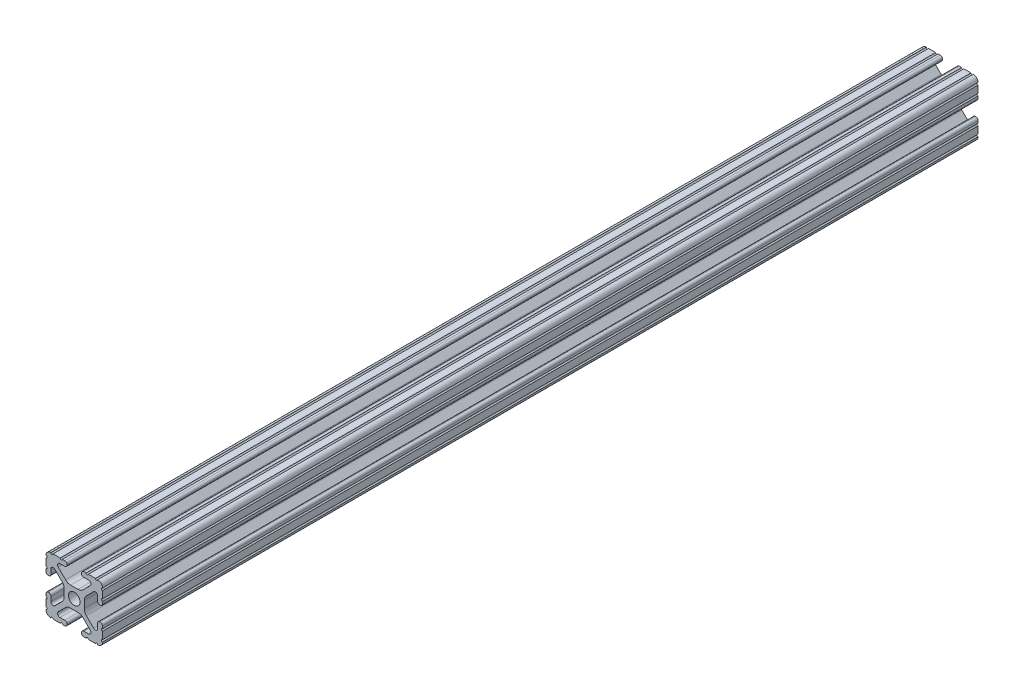
from build123d import *

# Parameters (mm, degrees)
SKETCH1_R           = 2.6035
BOSS_EXTRUDE1_DEPTH = 304.8
SKETCH4_W           = 111.881227381
SKETCH4_H           = 93.826727356
CUT_EXTRUDE3_DEPTH  = 215.9


with BuildPart() as part:
    # Sketch1 → Boss-Extrude1 (new, symmetric)
    with BuildSketch(Plane.XY):
        with BuildLine():
            Line((-7.179650497, -8.645192506), (-3.952270251, -5.423690499))
            ThreePointArc((-3.952270251, -5.423690499), (-2.922936451, -4.736929036), (-1.709253557, -4.4958))
            Line((-1.709253557, -4.4958), (1.709253557, -4.4958))
            ThreePointArc((1.709253557, -4.4958), (2.922936451, -4.736929036), (3.952270251, -5.423690499))
            Line((3.952270251, -5.423690499), (7.179650497, -8.645192506))
            ThreePointArc((7.179650497, -8.645192506), (7.41473083, -9.822813117), (6.416408329, -10.4902))
            Line((6.416408329, -10.4902), (4.287512407, -10.4902))
            ThreePointArc((4.287512407, -10.4902), (3.54574862, -10.79744862), (3.2385, -11.539212407))
            Line((3.2385, -11.539212407), (3.2385, -11.650987593))
            ThreePointArc((3.2385, -11.650987593), (3.54574862, -12.39275138), (4.287512407, -12.7))
            Line((4.287512407, -12.7), (5.317126718, -12.7))
            ThreePointArc((5.317126718, -12.7), (5.825126718, -12.192), (6.333126718, -12.7))
            Line((6.333126718, -12.7), (9.550443118, -12.7))
            ThreePointArc((9.550443118, -12.7), (10.058366869, -12.192000006), (10.566443095, -12.699847501))
            ThreePointArc((10.566443095, -12.699847501), (12.082537762, -12.08250727), (12.699846982, -10.566399977))
            ThreePointArc((12.699846982, -10.566399977), (12.192000006, -10.058323491), (12.7, -9.5504))
            Line((12.7, -9.5504), (12.7, -6.3330836))
            ThreePointArc((12.7, -6.3330836), (12.192, -5.8250836), (12.7, -5.3170836))
            Line((12.7, -5.3170836), (12.7, -4.287469289))
            ThreePointArc((12.7, -4.287469289), (12.39275138, -3.545705502), (11.650987593, -3.238456882))
            Line((11.650987593, -3.238456882), (11.539212407, -3.238456882))
            ThreePointArc((11.539212407, -3.238456882), (10.79744862, -3.545705502), (10.4902, -4.287469289))
            Line((10.4902, -4.287469289), (10.4902, -6.402089023))
            ThreePointArc((10.4902, -6.402089023), (9.856505071, -7.351067942), (8.737131347, -7.129408934))
            Line((8.737131347, -7.129408934), (5.441005833, -3.840816462))
            ThreePointArc((5.441005833, -3.840816462), (4.750877967, -2.809883091), (4.5085, -1.593185507))
            Line((4.5085, -1.593185507), (4.5085, 1.593185507))
            ThreePointArc((4.5085, 1.593185507), (4.750877967, 2.809883091), (5.441005833, 3.840816462))
            Line((5.441005833, 3.840816462), (8.737131347, 7.129408934))
            ThreePointArc((8.737131347, 7.129408934), (9.856505071, 7.351067942), (10.4902, 6.402089023))
            Line((10.4902, 6.402089023), (10.4902, 4.287469289))
            ThreePointArc((10.4902, 4.287469289), (10.79744862, 3.545705502), (11.539212407, 3.238456882))
            Line((11.539212407, 3.238456882), (11.650987593, 3.238456882))
            ThreePointArc((11.650987593, 3.238456882), (12.39275138, 3.545705502), (12.7, 4.287469289))
            Line((12.7, 4.287469289), (12.7, 5.3170836))
            ThreePointArc((12.7, 5.3170836), (12.192, 5.8250836), (12.7, 6.3330836))
            Line((12.7, 6.3330836), (12.7, 9.5504))
            ThreePointArc((12.7, 9.5504), (12.192000006, 10.058323491), (12.699846982, 10.566399977))
            ThreePointArc((12.699846982, 10.566399977), (12.082537762, 12.08250727), (10.566443095, 12.699847501))
            ThreePointArc((10.566443095, 12.699847501), (10.058366869, 12.192000006), (9.550443118, 12.7))
            Line((9.550443118, 12.7), (6.333126718, 12.7))
            ThreePointArc((6.333126718, 12.7), (5.825126718, 12.192), (5.317126718, 12.7))
            Line((5.317126718, 12.7), (4.287512407, 12.7))
            ThreePointArc((4.287512407, 12.7), (3.54574862, 12.39275138), (3.2385, 11.650987593))
            Line((3.2385, 11.650987593), (3.2385, 11.539212407))
            ThreePointArc((3.2385, 11.539212407), (3.54574862, 10.79744862), (4.287512407, 10.4902))
            Line((4.287512407, 10.4902), (6.476788598, 10.4902))
            ThreePointArc((6.476788598, 10.4902), (7.432222385, 9.85140422), (7.207036008, 8.724370562))
            Line((7.207036008, 8.724370562), (3.898272566, 5.423169045))
            ThreePointArc((3.898272566, 5.423169045), (2.869120213, 4.736787962), (1.655778399, 4.4958))
            Line((1.655778399, 4.4958), (-1.655778399, 4.4958))
            ThreePointArc((-1.655778399, 4.4958), (-2.869120213, 4.736787962), (-3.898272566, 5.423169045))
            Line((-3.898272566, 5.423169045), (-7.207036008, 8.724370562))
            ThreePointArc((-7.207036008, 8.724370562), (-7.432222385, 9.85140422), (-6.476788598, 10.4902))
            Line((-6.476788598, 10.4902), (-4.287512407, 10.4902))
            ThreePointArc((-4.287512407, 10.4902), (-3.54574862, 10.79744862), (-3.2385, 11.539212407))
            Line((-3.2385, 11.539212407), (-3.2385, 11.650987593))
            ThreePointArc((-3.2385, 11.650987593), (-3.54574862, 12.39275138), (-4.287512407, 12.7))
            Line((-4.287512407, 12.7), (-5.317126718, 12.7))
            ThreePointArc((-5.317126718, 12.7), (-5.825126718, 12.192), (-6.333126718, 12.7))
            Line((-6.333126718, 12.7), (-9.550443118, 12.7))
            ThreePointArc((-9.550443118, 12.7), (-10.058366869, 12.192000006), (-10.566443095, 12.699847501))
            ThreePointArc((-10.566443095, 12.699847501), (-12.082537762, 12.08250727), (-12.699846982, 10.566399977))
            ThreePointArc((-12.699846982, 10.566399977), (-12.192000006, 10.058323491), (-12.7, 9.5504))
            Line((-12.7, 9.5504), (-12.7, 6.3330836))
            ThreePointArc((-12.7, 6.3330836), (-12.192, 5.8250836), (-12.7, 5.3170836))
            Line((-12.7, 5.3170836), (-12.7, 4.287469289))
            ThreePointArc((-12.7, 4.287469289), (-12.39275138, 3.545705502), (-11.650987593, 3.238456882))
            Line((-11.650987593, 3.238456882), (-11.539212407, 3.238456882))
            ThreePointArc((-11.539212407, 3.238456882), (-10.79744862, 3.545705502), (-10.4902, 4.287469289))
            Line((-10.4902, 4.287469289), (-10.4902, 6.402089023))
            ThreePointArc((-10.4902, 6.402089023), (-9.856505071, 7.351067942), (-8.737131347, 7.129408934))
            Line((-8.737131347, 7.129408934), (-5.441005833, 3.840816462))
            ThreePointArc((-5.441005833, 3.840816462), (-4.750877967, 2.809883091), (-4.5085, 1.593185507))
            Line((-4.5085, 1.593185507), (-4.5085, -1.593185507))
            ThreePointArc((-4.5085, -1.593185507), (-4.750877967, -2.809883091), (-5.441005833, -3.840816462))
            Line((-5.441005833, -3.840816462), (-8.737131347, -7.129408934))
            ThreePointArc((-8.737131347, -7.129408934), (-9.856505071, -7.351067942), (-10.4902, -6.402089023))
            Line((-10.4902, -6.402089023), (-10.4902, -4.287469289))
            ThreePointArc((-10.4902, -4.287469289), (-10.79744862, -3.545705502), (-11.539212407, -3.238456882))
            Line((-11.539212407, -3.238456882), (-11.650987593, -3.238456882))
            ThreePointArc((-11.650987593, -3.238456882), (-12.39275138, -3.545705502), (-12.7, -4.287469289))
            Line((-12.7, -4.287469289), (-12.7, -5.3170836))
            ThreePointArc((-12.7, -5.3170836), (-12.192, -5.8250836), (-12.7, -6.3330836))
            Line((-12.7, -6.3330836), (-12.7, -9.5504))
            ThreePointArc((-12.7, -9.5504), (-12.192000006, -10.058323491), (-12.699846982, -10.566399977))
            ThreePointArc((-12.699846982, -10.566399977), (-12.082537762, -12.08250727), (-10.566443095, -12.699847501))
            ThreePointArc((-10.566443095, -12.699847501), (-10.058366869, -12.192000006), (-9.550443118, -12.7))
            Line((-9.550443118, -12.7), (-6.333126718, -12.7))
            ThreePointArc((-6.333126718, -12.7), (-5.825126718, -12.192), (-5.317126718, -12.7))
            Line((-5.317126718, -12.7), (-4.287512407, -12.7))
            ThreePointArc((-4.287512407, -12.7), (-3.54574862, -12.39275138), (-3.2385, -11.650987593))
            Line((-3.2385, -11.650987593), (-3.2385, -11.539212407))
            ThreePointArc((-3.2385, -11.539212407), (-3.54574862, -10.79744862), (-4.287512407, -10.4902))
            Line((-4.287512407, -10.4902), (-6.416408329, -10.4902))
            ThreePointArc((-6.416408329, -10.4902), (-7.41473083, -9.822813117), (-7.179650497, -8.645192506))
        make_face()
        with Locations(Location((0, 0, 0), (0, 0, 180))):
            Circle(SKETCH1_R, mode=Mode.SUBTRACT)
    extrude(amount=BOSS_EXTRUDE1_DEPTH, both=True)

    # Sketch4 → Cut-Extrude3 (cut)
    with BuildSketch(Plane.XY.offset(304.8)):
        with Locations((2.032955477, -7.149022102)):
            Rectangle(SKETCH4_W, SKETCH4_H)
    extrude(amount=-CUT_EXTRUDE3_DEPTH, mode=Mode.SUBTRACT)


solid = part.part
